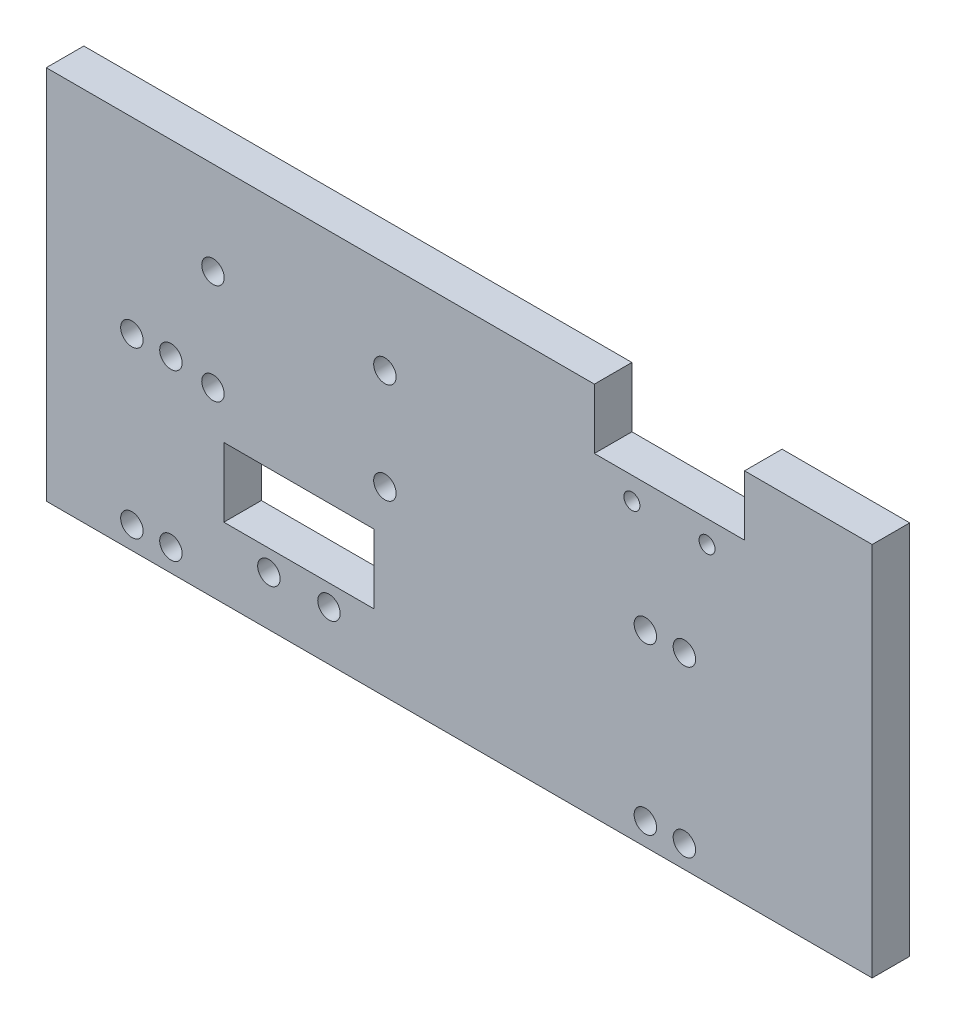
from build123d import *

# Parameters (mm, degrees)
SKETCH1_W                     = 254
SKETCH1_H                     = 63.5
BOSS_EXTRUDE1_DEPTH           = 6.35
F_6_CLEARANCE_HOLE1_D         = 3.7973
F_6_CLEARANCE_HOLE1_DEPTH     = 6.35
F_6_CLEARANCE_HOLE1_TIP       = 1.140824014
F_6_CLEARANCE_HOLE2_D         = 3.7973
F_6_CLEARANCE_HOLE2_DEPTH     = 7.62
F_6_CLEARANCE_HOLE2_TIP       = 1.140824014
SKETCH21_W                    = 12.7
SKETCH21_H                    = 11.684
CUT_EXTRUDE7_DEPTH            = 132.062523247
F_6_CLEARANCE_HOLE3_D         = 3.7973
F_6_CLEARANCE_HOLE3_DEPTH     = 7.62
F_6_CLEARANCE_HOLE3_TIP       = 1.140824014
F_6_CLEARANCE_HOLE4_D         = 3.7973
F_6_CLEARANCE_HOLE4_DEPTH     = 7.62
F_6_CLEARANCE_HOLE4_TIP       = 1.140824014
SKETCH27_W                    = 114.3
SKETCH27_H                    = 63.5
CUT_EXTRUDE9_DEPTH            = 132.062523247
SKETCH28_W                    = 25.4
SKETCH28_H                    = 10.16
CUT_EXTRUDE10_DEPTH           = 33.02
TAP_DRILL_FOR_6_32_TAP1_D     = 2.7051
TAP_DRILL_FOR_6_32_TAP1_DEPTH = 10.16
TAP_DRILL_FOR_6_32_TAP1_TIP   = 0.81269403
F_6_CLEARANCE_HOLE5_D         = 3.7973
F_6_CLEARANCE_HOLE5_DEPTH     = 10.16
F_6_CLEARANCE_HOLE5_TIP       = 1.140824014


with BuildPart() as part:
    # Sketch1 → Boss-Extrude1 (new body)
    with BuildSketch(Plane.XY):
        Rectangle(SKETCH1_W, SKETCH1_H)
    extrude(amount=BOSS_EXTRUDE1_DEPTH)

    # #6 Clearance Hole1
    with Locations(Plane.XY.offset(6.35)):
        with Locations((-105.918, 0), (-112.522, -27.94), (-112.522, 0), (-105.918, -27.94)):
            Hole(F_6_CLEARANCE_HOLE1_D / 2, depth=F_6_CLEARANCE_HOLE1_DEPTH)
            with Locations((0, 0, -(F_6_CLEARANCE_HOLE1_DEPTH + F_6_CLEARANCE_HOLE1_TIP / 2))):  # 118° drill point
                Cone(0, F_6_CLEARANCE_HOLE1_D / 2, F_6_CLEARANCE_HOLE1_TIP, mode=Mode.SUBTRACT)

    # #6 Clearance Hole2
    with Locations(Plane(origin=(0, 0, 0), x_dir=(-1, 0, 0), z_dir=(0, 0, -1))):
        with Locations((98.806, -1.016), (69.723, -1.016)):
            Hole(F_6_CLEARANCE_HOLE2_D / 2, depth=F_6_CLEARANCE_HOLE2_DEPTH)
            with Locations((0, 0, -(F_6_CLEARANCE_HOLE2_DEPTH + F_6_CLEARANCE_HOLE2_TIP / 2))):  # 118° drill point
                Cone(0, F_6_CLEARANCE_HOLE2_D / 2, F_6_CLEARANCE_HOLE2_TIP, mode=Mode.SUBTRACT)

    # Sketch21 → Cut-Extrude7 (cut, through all)
    with BuildSketch(Plane(origin=(0, 0, 0), x_dir=(-1, 0, 0), z_dir=(0, 0, -1))):
        with Locations((77.9145, -13.97)):
            Rectangle(SKETCH21_W, SKETCH21_H)
        with Locations((90.6145, -13.97)):
            Rectangle(SKETCH21_W, SKETCH21_H)
    extrude(amount=-CUT_EXTRUDE7_DEPTH, mode=Mode.SUBTRACT)

    # #6 Clearance Hole3
    with Locations(Plane(origin=(0, 0, 0), x_dir=(-1, 0, 0), z_dir=(0, 0, -1))):
        with Locations((69.723, 16.002), (98.806, 16.002)):
            Hole(F_6_CLEARANCE_HOLE3_D / 2, depth=F_6_CLEARANCE_HOLE3_DEPTH)
            with Locations((0, 0, -(F_6_CLEARANCE_HOLE3_DEPTH + F_6_CLEARANCE_HOLE3_TIP / 2))):  # 118° drill point
                Cone(0, F_6_CLEARANCE_HOLE3_D / 2, F_6_CLEARANCE_HOLE3_TIP, mode=Mode.SUBTRACT)

    # #6 Clearance Hole4
    with Locations(Plane(origin=(0, 0, 0), x_dir=(-1, 0, 0), z_dir=(0, 0, -1))):
        with Locations((79.1845, -23.35276), (89.3445, -23.35276)):
            Hole(F_6_CLEARANCE_HOLE4_D / 2, depth=F_6_CLEARANCE_HOLE4_DEPTH)
            with Locations((0, 0, -(F_6_CLEARANCE_HOLE4_DEPTH + F_6_CLEARANCE_HOLE4_TIP / 2))):  # 118° drill point
                Cone(0, F_6_CLEARANCE_HOLE4_D / 2, F_6_CLEARANCE_HOLE4_TIP, mode=Mode.SUBTRACT)

    # Sketch27 → Cut-Extrude9 (cut, through all)
    with BuildSketch(Plane.XY.offset(6.35)):
        with Locations((69.85, 0)):
            Rectangle(SKETCH27_W, SKETCH27_H)
    extrude(amount=-CUT_EXTRUDE9_DEPTH, mode=Mode.SUBTRACT)

    # Sketch28 → Cut-Extrude10 (cut)
    with BuildSketch(Plane.XY.offset(6.35)):
        with Locations((-21.59, 26.67)):
            Rectangle(SKETCH28_W, SKETCH28_H)
    extrude(amount=-CUT_EXTRUDE10_DEPTH, mode=Mode.SUBTRACT)

    # Tap Drill for #6-32 Tap1
    with Locations(Plane.XY.offset(6.35)):
        with Locations((-27.94, 17.78), (-15.24, 17.78)):
            Hole(TAP_DRILL_FOR_6_32_TAP1_D / 2, depth=TAP_DRILL_FOR_6_32_TAP1_DEPTH)
            with Locations((0, 0, -(TAP_DRILL_FOR_6_32_TAP1_DEPTH + TAP_DRILL_FOR_6_32_TAP1_TIP / 2))):  # 118° drill point
                Cone(0, TAP_DRILL_FOR_6_32_TAP1_D / 2, TAP_DRILL_FOR_6_32_TAP1_TIP, mode=Mode.SUBTRACT)

    # #6 Clearance Hole5
    with Locations(Plane.XY.offset(6.35)):
        with Locations((-25.668797482, 0), (-19.064797482, 0), (-25.668797482, -27.94), (-19.064797482, -27.94)):
            Hole(F_6_CLEARANCE_HOLE5_D / 2, depth=F_6_CLEARANCE_HOLE5_DEPTH)
            with Locations((0, 0, -(F_6_CLEARANCE_HOLE5_DEPTH + F_6_CLEARANCE_HOLE5_TIP / 2))):  # 118° drill point
                Cone(0, F_6_CLEARANCE_HOLE5_D / 2, F_6_CLEARANCE_HOLE5_TIP, mode=Mode.SUBTRACT)


solid = part.part
